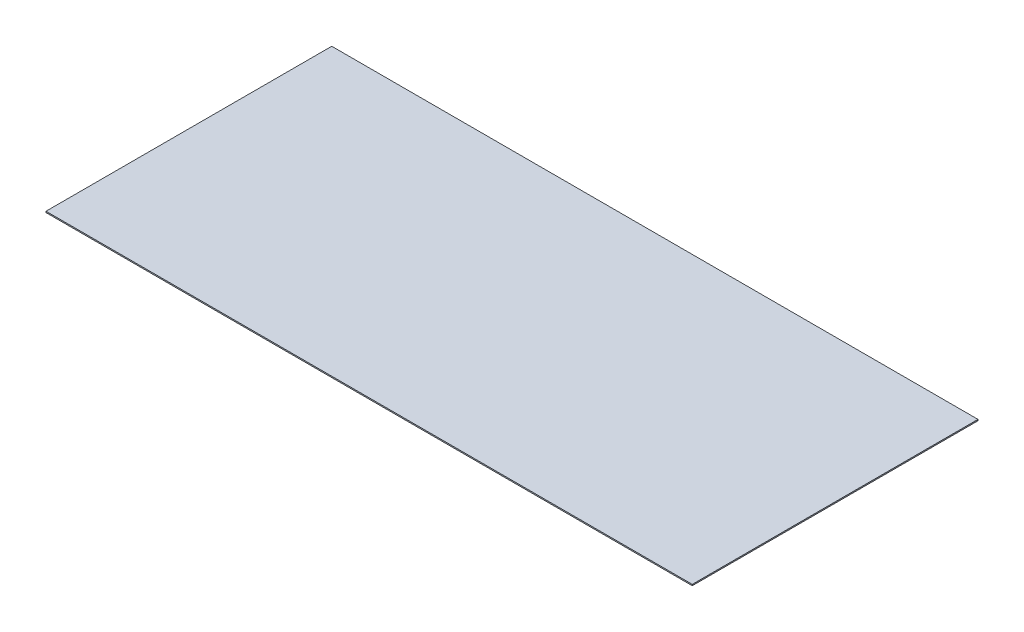
from build123d import *

# Parameters (mm, degrees)
SKETCH1_W           = 1685
SKETCH1_H           = 745
BOSS_EXTRUDE1_DEPTH = 3.175


with BuildPart() as part:
    # Sketch1 → Boss-Extrude1 (new body)
    with BuildSketch(Plane(origin=(0, 0, 0), x_dir=(1, 0, 0), z_dir=(0, 1, 0))):
        Rectangle(SKETCH1_W, SKETCH1_H)
    extrude(amount=BOSS_EXTRUDE1_DEPTH)


solid = part.part
